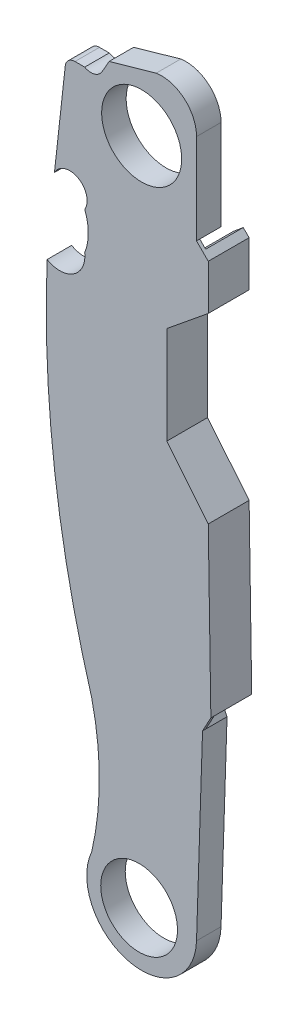
from build123d import *

# Parameters (mm, degrees)
SKETCH1_R           = 3.1115
SKETCH1_R_2         = 2.9845
BOSS_EXTRUDE1_DEPTH = 1.905
CUT_EXTRUDE1_DEPTH  = 1.651
BOSS_EXTRUDE2_START = 1.27
BOSS_EXTRUDE2_DEPTH = 1.27
FILLET1_R           = 0.762
SCALE1_SCALE        = 1.0350841


with BuildPart() as part:
    # Sketch1 → Boss-Extrude1 (new body)
    with BuildSketch(Plane.XY):
        with BuildLine():
            Line((11.455137598, 2.171678291), (10.988691825, -12.194362723))
            ThreePointArc((10.988691825, -12.194362723), (5.753403312, -16.215064409), (2.835732355, -10.293790556))
            ThreePointArc((2.835732355, -10.293790556), (3.433990562, -5.092237988), (2.835732355, 0.109314579))
            ThreePointArc((2.835732355, 0.109314579), (-0.031028462, 13.845472924), (-0.62536344, 27.864999648))
            ThreePointArc((-0.62536344, 27.864999648), (1.430712022, 27.922734075), (2.296539191, 29.788510826))
            ThreePointArc((2.296539191, 29.788510826), (2.577489408, 31.240527695), (2.296539191, 32.692544565))
            ThreePointArc((2.296539191, 32.692544565), (1.793167017, 34.551137871), (-0.054485013, 34.008980516))
            Line((-0.054485013, 34.008980516), (0.8585336, 42.2777508))
            Line((0.8585336, 42.2777508), (2.296539191, 42.2777508))
            ThreePointArc((2.296539191, 42.2777508), (3.056005554, 42.188646363), (3.657600202, 42.660676697))
            Line((3.657600202, 42.660676697), (4.193229273, 43.60832813))
            Line((4.193229273, 43.60832813), (7.858351578, 44.652580854))
            ThreePointArc((7.858351578, 44.652580854), (10.042305559, 44.016121117), (10.988691825, 41.94752521))
            Line((10.988691825, 41.94752521), (10.988691825, 34.921067581))
            Line((10.988691825, 34.921067581), (11.90077889, 34.008980516))
            Line((11.90077889, 34.008980516), (11.90077889, 30.495455397))
            Line((11.90077889, 30.495455397), (8.673783219, 27.864999648))
            Line((8.673783219, 27.864999648), (8.673783219, 20.285030353))
            Line((8.673783219, 20.285030353), (11.90077889, 16.326210266))
            Line((11.90077889, 16.326210266), (12.102967643, 3.372738413))
            Line((12.102967643, 3.372738413), (11.455137598, 2.171678291))
        make_face()
        with Locations(Location((6.72245078, 39.860230894, 0), (0, 0, 180))):
            Circle(SKETCH1_R, mode=Mode.SUBTRACT)
        with Locations(Location((6.525698673, -12.20338788, 0), (0, 0, 180))):
            Circle(SKETCH1_R_2, mode=Mode.SUBTRACT)
    extrude(amount=BOSS_EXTRUDE1_DEPTH)

    # Sketch7 → Cut-Extrude1 (cut)
    with BuildSketch(Plane(origin=(0, 0, 0), x_dir=(-1, 0, 0), z_dir=(0, 0, -1))):
        with BuildLine():
            Line((-12.102967643, 3.372738413), (-11.455137598, 2.171678291))
            ThreePointArc((-11.455137598, 2.171678291), (-6.980280612, 14.413742368), (-6.117233468, 27.41941911))
            ThreePointArc((-6.117233468, 27.41941911), (-7.707175586, 31.719484817), (-10.988691825, 34.921067581))
            Line((-10.988691825, 34.921067581), (-11.444735357, 34.465024049))
            ThreePointArc((-11.444735357, 34.465024049), (-8.702145747, 31.480644967), (-7.139396786, 27.740841235))
            ThreePointArc((-7.139396786, 27.740841235), (-7.956577994, 15.217724405), (-12.102967643, 3.372738413))
        make_face()
    extrude(amount=-CUT_EXTRUDE1_DEPTH, mode=Mode.SUBTRACT)

    # Sketch8 → Boss-Extrude2 (add)
    with BuildSketch(Plane(origin=(0, 0, 0), x_dir=(-1, 0, 0), z_dir=(0, 0, -1)).offset(BOSS_EXTRUDE2_START)):
        with BuildLine():
            Line((-11.90077889, 16.326210266), (-12.102967643, 3.372738413))
            ThreePointArc((-12.102967643, 3.372738413), (-7.956577994, 15.217724405), (-7.139396786, 27.740841235))
            ThreePointArc((-7.139396786, 27.740841235), (-8.702145747, 31.480644967), (-11.444735357, 34.465024049))
            Line((-11.444735357, 34.465024049), (-11.90077889, 34.008980516))
            Line((-11.90077889, 34.008980516), (-11.90077889, 30.495455397))
            Line((-11.90077889, 30.495455397), (-8.673783219, 27.864999648))
            Line((-8.673783219, 27.864999648), (-8.673783219, 20.285030353))
            Line((-8.673783219, 20.285030353), (-11.90077889, 16.326210266))
        make_face()
    extrude(amount=-BOSS_EXTRUDE2_DEPTH)

    # Fillet1
    fillet1_edges = [part.edges().sort_by_distance(p)[0] for p in [
        (0.8585336, 42.2777508, 0.9525),
    ]]
    fillet(fillet1_edges, radius=FILLET1_R)


with BuildPart() as part_1:
    # Scale1: scaled about (6.266812803, 15.225745721, 0.817427893)
    add(part.part.scale(SCALE1_SCALE).moved(Location((-0.219865487, -0.534181585, -0.028678722))))


solid = part_1.part
